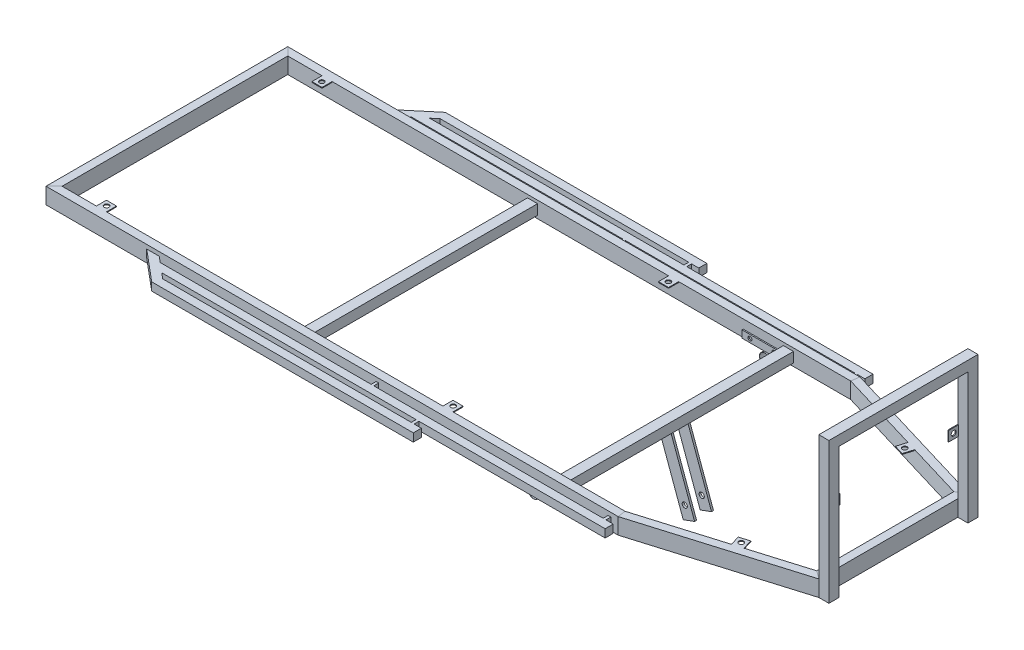
from build123d import *

# Parameters (mm, degrees)
SKETCH2_W                 = 20
SKETCH2_H                 = 40
SKETCH2_W_2               = 18
SKETCH2_H_2               = 38
SKETCH3_W                 = 25
SKETCH3_H                 = 25
SKETCH3_W_2               = 23
SKETCH3_H_2               = 23
EXTRUDE_THIN1_DEPTH       = 560
BOSS_EXTRUDE1_REACH       = 1896.415
BOSS_EXTRUDE5_DEPTH       = 25
BOSS_EXTRUDE6_DEPTH       = 10
BOSS_EXTRUDE7_DEPTH       = 20
SKETCH10_W                = 7
SKETCH10_H                = 12
SKETCH10_H_2              = 12.278760969
SKETCH10_W_2              = 6.5
BOSS_EXTRUDE8_DEPTH       = 20
SKETCH11_W                = 25
SKETCH11_H                = 25
SKETCH11_R                = 6
BOSS_EXTRUDE9_DEPTH       = 2
SKETCH12_W                = 25
SKETCH12_H                = 25
SKETCH12_R                = 6
BOSS_EXTRUDE10_DEPTH      = 2
SKETCH18_W                = 100
SKETCH18_H                = 18
SKETCH18_R                = 5
BOSS_EXTRUDE14_DEPTH      = 3
BOSS_EXTRUDE15_DEPTH      = 3
BOSS_EXTRUDE15_DEPTH_BACK = 23
SKETCH20_R                = 13.5
SKETCH20_R_2              = 13
SKETCH22_R                = 6.5
BOSS_EXTRUDE16_DEPTH      = 5
BOSS_EXTRUDE18_REACH      = 1971.563
SKETCH5_R                 = 12


with BuildPart() as part:
    # Sweep1: sweep along a path in Sketch1
    with BuildLine(Plane(origin=(0, 0, 0), x_dir=(1, 0, 0), z_dir=(0, 1, 0))) as sweep1_path:
        Line((0, 0), (0, 600))
        Line((0, 600), (1420, 600))
        Line((1420, 600), (1803, 485))
        Line((1803, 485), (1803, 115))
        Line((1803, 115), (1420, 0))
        Line((1420, 0), (0, 0))
    # Sketch2 → Sweep1 (sweep)
    with BuildSketch(Plane(origin=(0, 0, -600), x_dir=(-1, 0, 0), z_dir=(0, 0, -1))):
        with Locations((-10, 20)):
            Rectangle(SKETCH2_W, SKETCH2_H)
        with Locations((-10, 20)):
            Rectangle(SKETCH2_W_2, SKETCH2_H_2, mode=Mode.SUBTRACT)
    sweep(path=sweep1_path.line, transition=Transition.RIGHT)

    # Sketch3 → Extrude-Thin1 (add)
    with BuildSketch(Plane.XY.offset(-580)):
        with Locations((627.5, 20)):
            Rectangle(SKETCH3_W, SKETCH3_H)
        with Locations((627.5, 20)):
            Rectangle(SKETCH3_W_2, SKETCH3_H_2, mode=Mode.SUBTRACT)
    extrude(amount=EXTRUDE_THIN1_DEPTH)

    # Sketch4 → Boss-Extrude1 (add, up to next)
    with BuildSketch(Plane.XY.offset(-580), mode=Mode.PRIVATE) as boss_extrude1_sk1:
        Polygon((1250, 31.5), (1274, 31.5), (1274, 7.5), (1275, 7.5), (1275, 32.5), (1250, 32.5), align=None)
    boss_extrude1_tool1 = extrude(boss_extrude1_sk1.sketch, amount=BOSS_EXTRUDE1_REACH, mode=Mode.PRIVATE) - part.part
    add(boss_extrude1_tool1.solids().sort_by_distance((1262, 31.853553, -580))[0])

    # Sketch7 → Boss-Extrude6 (add, symmetric)
    with BuildSketch(Plane(origin=(0, 20, 0), x_dir=(-1, 0, 0), z_dir=(0, -1, 0))):
        Polygon((-250, 600), (-326.604444312, 664.278760969), (-357.718920849, 664.278760969), (-281.114476537, 600), align=None)
    extrude(amount=BOSS_EXTRUDE6_DEPTH, both=True)

    # Sketch8 → Boss-Extrude7 (add)
    with BuildSketch(Plane(origin=(0, 30, 0), x_dir=(1, 0, 0), z_dir=(0, 1, 0))):
        Polygon((357.718920849, 664.278760969), (975.801384923, 664.278760969), (975.801384923, 644.278760969), (333.883848997, 644.278760969), align=None)
        Polygon((295.747734034, 612.278760969), (1420, 612.278760969), (1420, 632.278760969), (319.582805886, 632.278760969), align=None)
    extrude(amount=-BOSS_EXTRUDE7_DEPTH)

    # Sketch10 → Boss-Extrude8 (add)
    with BuildSketch(Plane(origin=(0, 30, 0), x_dir=(1, 0, 0), z_dir=(0, 1, 0))):
        with Locations((954.301384923, 638.278760969)):
            Rectangle(SKETCH10_W, SKETCH10_H)
        with Locations((1398.5, 606.139380484)):
            Rectangle(SKETCH10_W, SKETCH10_H_2)
        with Locations((822.551384923, 606.139380484)):
            Rectangle(SKETCH10_W_2, SKETCH10_H_2)
    extrude(amount=-BOSS_EXTRUDE8_DEPTH)

    # Mirror2: part across plane


with BuildPart() as body_2:
    # Sketch6 → Boss-Extrude5 (new body)
    with BuildSketch(Plane(origin=(1803, 0, 0), x_dir=(0, 0, -1), z_dir=(1, 0, 0))):
        Polygon((460, 25), (460, 325), (140, 325), (140, 25), (140, 0), (115, 0), (115, 350), (485, 350), (485, 0), (460, 0), align=None)
    extrude(amount=BOSS_EXTRUDE5_DEPTH)

    # Sketch12 → Boss-Extrude10 (add)
    # profile 1 of 2: a face of its own
    with BuildSketch(Plane.ZY.offset(-1803)):
        with Locations((-447.5, 187.5)):
            Rectangle(SKETCH12_W, SKETCH12_H)
        with Locations((-447.5, 188)):
            Circle(SKETCH12_R, mode=Mode.SUBTRACT)
    # profile 2 of 2: a face of its own
    with BuildSketch(Plane.ZY.offset(-1803)):
        with Locations((-152.5, 187.5)):
            Rectangle(SKETCH12_W, SKETCH12_H)
        with Locations(Location((-152.5, 188, 0), (0, 0, 180))):
            Circle(SKETCH12_R, mode=Mode.SUBTRACT)
    extrude(amount=-BOSS_EXTRUDE10_DEPTH)


with BuildPart() as part_1:
    add(part.part)
    add(part.part.mirror(Plane.XY.offset(-300)))

    # Sketch11 → Boss-Extrude9 (add)
    # profile 1 of 6: a face of its own
    with BuildSketch(Plane(origin=(0, 40, 0), x_dir=(1, 0, 0), z_dir=(0, 1, 0))):
        with Locations((117.5, 32.5)):
            Rectangle(SKETCH11_W, SKETCH11_H)
        with Locations(Location((117.5, 33, 0), (0, 0, 270))):
            Circle(SKETCH11_R, mode=Mode.SUBTRACT)
    # profile 2 of 6: a face of its own
    with BuildSketch(Plane(origin=(0, 40, 0), x_dir=(1, 0, 0), z_dir=(0, 1, 0))):
        with Locations((977.5, 32.5)):
            Rectangle(SKETCH11_W, SKETCH11_H)
        with Locations(Location((977.5, 33, 0), (0, 0, 270))):
            Circle(SKETCH11_R, mode=Mode.SUBTRACT)
    # profile 3 of 6: a face of its own
    with BuildSketch(Plane(origin=(0, 40, 0), x_dir=(1, 0, 0), z_dir=(0, 1, 0))):
        Polygon((1620.181236576, 80.988751742), (1644.125172374, 88.178184162), (1636.935739954, 112.122119959), (1612.991804156, 104.93268754), align=None)
        with Locations(Location((1628.414699616, 97.034314567, 0), (0, 0, 270))):
            Circle(SKETCH11_R, mode=Mode.SUBTRACT)
    # profile 4 of 6: a face of its own
    with BuildSketch(Plane(origin=(0, 40, 0), x_dir=(1, 0, 0), z_dir=(0, 1, 0))):
        with Locations((977.5, 567.5)):
            Rectangle(SKETCH11_W, SKETCH11_H)
        with Locations(Location((977.5, 567, 0), (0, 0, 90))):
            Circle(SKETCH11_R, mode=Mode.SUBTRACT)
    # profile 5 of 6: a face of its own
    with BuildSketch(Plane(origin=(0, 40, 0), x_dir=(1, 0, 0), z_dir=(0, 1, 0))):
        with Locations((117.5, 567.5)):
            Rectangle(SKETCH11_W, SKETCH11_H)
        with Locations(Location((117.5, 567, 0), (0, 0, 90))):
            Circle(SKETCH11_R, mode=Mode.SUBTRACT)
    # profile 6 of 6: a face of its own
    with BuildSketch(Plane(origin=(0, 40, 0), x_dir=(1, 0, 0), z_dir=(0, 1, 0))):
        Polygon((1620.181236576, 519.011248258), (1644.125172374, 511.821815838), (1636.935739954, 487.877880041), (1612.991804156, 495.06731246), align=None)
        with Locations(Location((1628.414699616, 502.965685433, 0), (0, 0, 90))):
            Circle(SKETCH11_R, mode=Mode.SUBTRACT)
    extrude(amount=-BOSS_EXTRUDE9_DEPTH)

    # Sketch22 → Boss-Extrude16 (add)
    with BuildSketch(Plane.XY.offset(-276.5)):
        Polygon((1275, 7.5), (1333.140385275, -152.2393957), (1304.949606651, -162.5), (1243.074666826, 7.5), align=None)
        with Locations((1308.784391663, -129.178919227)):
            Circle(SKETCH22_R, mode=Mode.SUBTRACT)
    boss_extrude16 = extrude(amount=-BOSS_EXTRUDE16_DEPTH)

    # Mirror8: Boss-Extrude16 across plane
    add(boss_extrude16.mirror(Plane.XY.offset(-300)))


with BuildPart() as body_3:
    # Sketch18 → Boss-Extrude14 (new body)
    with BuildSketch(Plane(origin=(0, 0, -20), x_dir=(-1, 0, 0), z_dir=(0, 0, -1))):
        with Locations((-1200, 9)):
            Rectangle(SKETCH18_W, SKETCH18_H)
        with Locations((-1230, 9)):
            Circle(SKETCH18_R, mode=Mode.SUBTRACT)
        with Locations((-1170, 9)):
            Circle(SKETCH18_R, mode=Mode.SUBTRACT)
    extrude(amount=BOSS_EXTRUDE14_DEPTH)


with BuildPart() as body_4:
    # Sketch20 → Boss-Extrude15 (new, two sides: drawn at the far end of the back side and taken through both)
    with BuildSketch(Plane(origin=(0, 0, -23), x_dir=(-1, 0, 0), z_dir=(0, 0, -1)).offset(-BOSS_EXTRUDE15_DEPTH_BACK)):
        with Locations((-1210, -13.5)):
            Circle(SKETCH20_R)
        with Locations((-1210, -13.5)):
            Circle(SKETCH20_R_2, mode=Mode.SUBTRACT)
    extrude(amount=BOSS_EXTRUDE15_DEPTH + BOSS_EXTRUDE15_DEPTH_BACK)


with BuildPart() as body_5:
    # Mirror7: mirrored copy
    add(body_3.part.mirror(Plane.XY.offset(-300)))


with BuildPart() as body_6:
    # Mirror7 2: mirrored copy
    add(body_4.part.mirror(Plane.XY.offset(-300)))


with BuildPart() as body_7:

    # Sketch5 → Boss-Extrude18 (new, up to next)
    with BuildSketch(Plane.XY.offset(-580), mode=Mode.PRIVATE) as boss_extrude18_sk1:
        with Locations(Location((1262, 19.5, 0), (0, 0, 180))):
            Circle(SKETCH5_R)
    boss_extrude18_tool1 = extrude(boss_extrude18_sk1.sketch, amount=BOSS_EXTRUDE18_REACH, mode=Mode.PRIVATE) - part_1.part
    add(boss_extrude18_tool1.solids().sort_by_distance((1262, 19.5, -580))[0])


solid = Compound([body_2.part, part_1.part, body_3.part, body_4.part, body_5.part, body_6.part, body_7.part])
